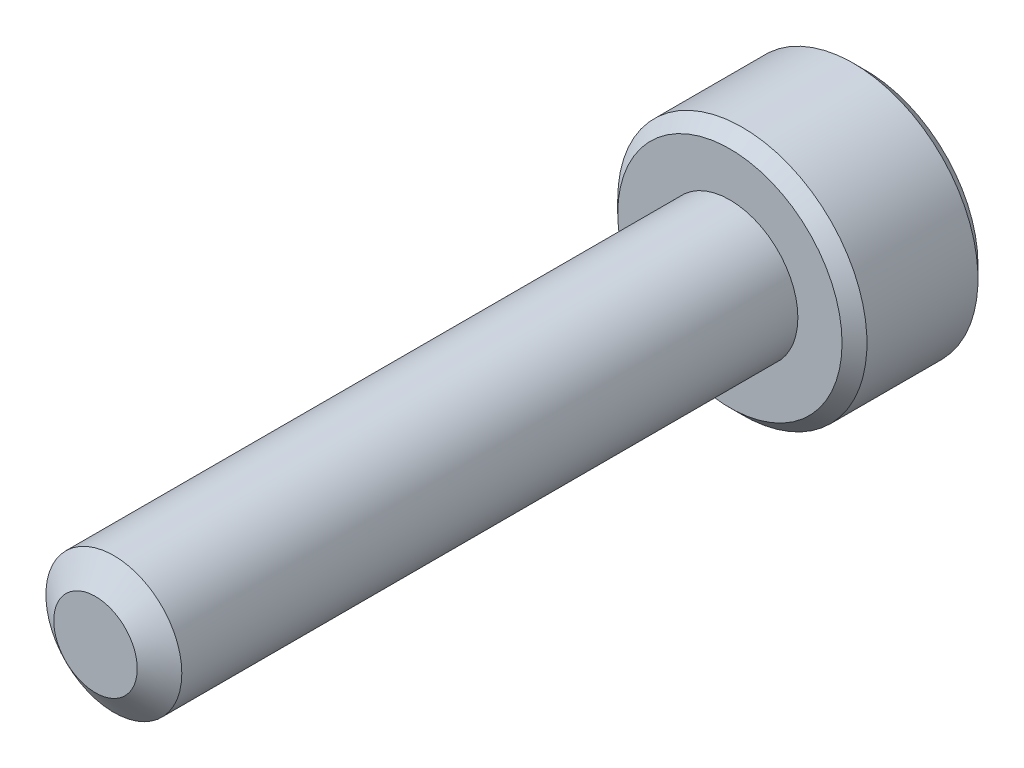
from build123d import *

# Parameters (mm, degrees)
SKETCH1_R          = 1.5
EXTRUDE1_DEPTH     = 14
SKETCH6_R          = 2.75
EXTRUDE2_DEPTH     = 3
CUT_EXTRUDE1_DEPTH = 1.875
CHAMFER1_SIZE      = 0.275


with BuildPart() as part:
    # Sketch1 → Extrude1 (new body)
    with BuildSketch(Plane.XY):
        Circle(SKETCH1_R)
    extrude(amount=-EXTRUDE1_DEPTH)

    # Sketch4 → Cut-Revolve1 (revolve, cut)
    with BuildSketch(Plane(origin=(0, 0, 0), x_dir=(0, 0, -1), z_dir=(1, 0, 0)), mode=Mode.PRIVATE) as cut_revolve1_sk:
        Polygon((0.405251783, 1.5), (0, 0.921240474), (0, 1.5), align=None)
    revolve(cut_revolve1_sk.sketch.rotate(Axis((0, 0, 0), (0, 0, -1)), 90), axis=Axis((0, 0, 0), (0, 0, -1)), mode=Mode.SUBTRACT)

    # Sketch6 → Extrude2 (add)
    with BuildSketch(Plane(origin=(0, 0, -14), x_dir=(-1, 0, 0), z_dir=(0, 0, -1))):
        Circle(SKETCH6_R)
    extrude(amount=EXTRUDE2_DEPTH)

    # Sketch7 → Cut-Extrude1 (cut)
    with BuildSketch(Plane(origin=(0, 0, -17), x_dir=(-1, 0, 0), z_dir=(0, 0, -1))):
        Polygon((0, 1.443375673), (-1.25, 0.721687836), (-1.25, -0.721687836), (0, -1.443375673), (1.25, -0.721687836), (1.25, 0.721687836), align=None)
    extrude(amount=-CUT_EXTRUDE1_DEPTH, mode=Mode.SUBTRACT)

    # Cut-Extrude2 cone 1 section (through the dimple's axis) → Cut-Extrude2 (revolve, cut)
    with BuildSketch(Plane(origin=(0, 0, -17), x_dir=(0, 1, 0), z_dir=(1, 0, 0))):
        Polygon((0, 0), (1.443375673, 0), (0, 1.443375673), align=None)
    revolve(axis=Axis((0, 0, -17), (0, 0, 1)), mode=Mode.SUBTRACT)

    # Chamfer1
    chamfer1_edges = [part.edges().sort_by_distance(p)[0] for p in [
        (2.75, 0, -14),
        (2.75, 0, -17),
    ]]
    chamfer(chamfer1_edges, length=CHAMFER1_SIZE)


solid = part.part
